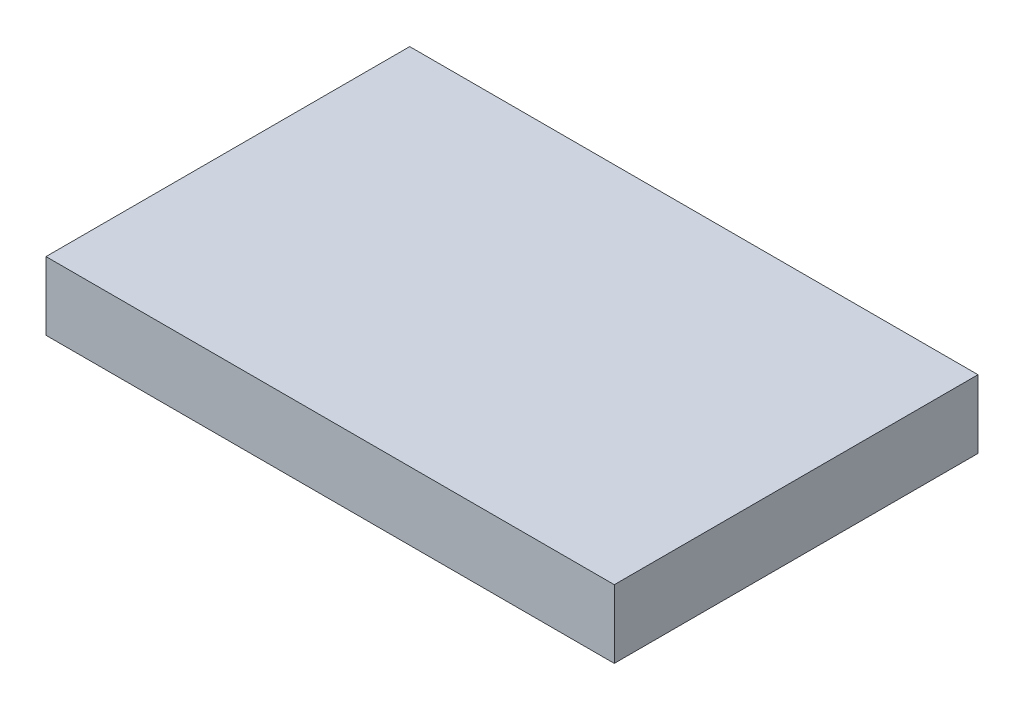
from build123d import *

# Parameters (mm, degrees)
SKETCH_1_W      = 25
SKETCH_1_H      = 16
EXTRUDE_1_DEPTH = 3


with BuildPart() as part:
    # 草图1 → 凸台-拉伸1 (new body)
    with BuildSketch(Plane(origin=(0, 0, 0), x_dir=(1, 0, 0), z_dir=(0, 1, 0))):
        Rectangle(SKETCH_1_W, SKETCH_1_H)
    extrude(amount=EXTRUDE_1_DEPTH)


solid = part.part
